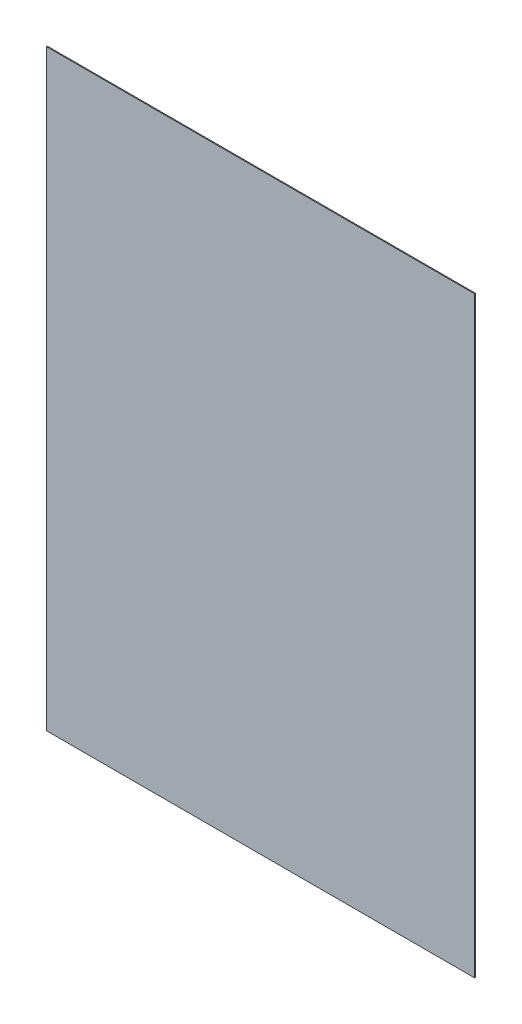
from build123d import *

# Parameters (mm, degrees)
SKETCH1_W           = 470
SKETCH1_H           = 650
BOSS_EXTRUDE1_DEPTH = 1


with BuildPart() as part:
    # Sketch1 → Boss-Extrude1 (new body)
    with BuildSketch(Plane.XY):
        with Locations((-205.094936709, -157.014767932)):
            Rectangle(SKETCH1_W, SKETCH1_H)
    extrude(amount=BOSS_EXTRUDE1_DEPTH)


solid = part.part
